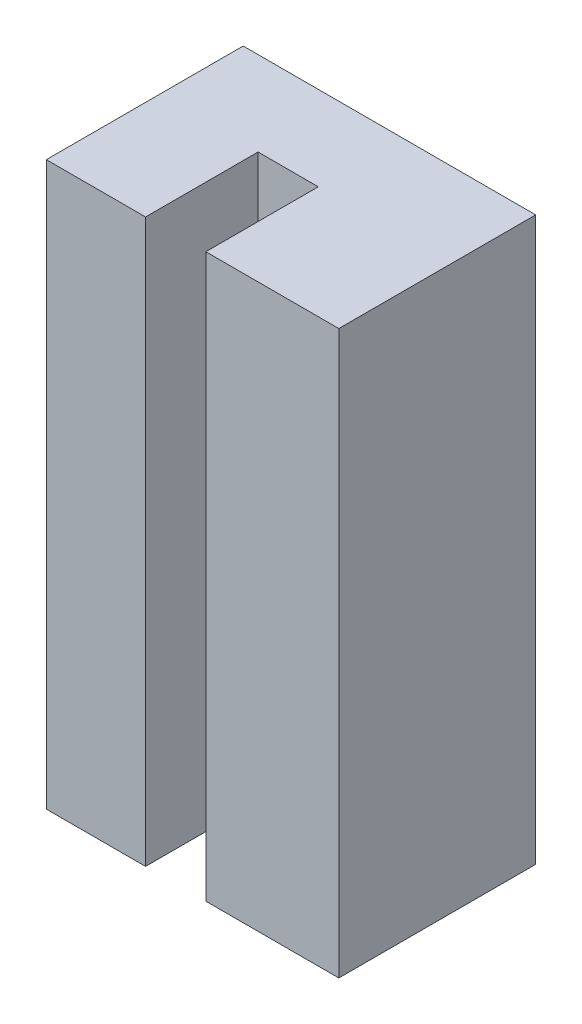
from build123d import *

# Parameters (mm, degrees)
SKETCH_1_W          = 5.2
SKETCH_1_H          = 3.5
EXTRUDE_1_DEPTH     = 10
SKETCH_2_W          = 1.07112
SKETCH_2_H          = 2
CUT_EXTRUDE_1_DEPTH = 10


with BuildPart() as part:
    # Эскиз1 → Бобышка-Вытянуть1 (new body)
    with BuildSketch(Plane(origin=(0, 0, 0), x_dir=(1, 0, 0), z_dir=(0, 1, 0))):
        with Locations((2.6, 1.75)):
            Rectangle(SKETCH_1_W, SKETCH_1_H)
    extrude(amount=EXTRUDE_1_DEPTH)

    # Эскиз2 → Вырез-Вытянуть1 (cut)
    with BuildSketch(Plane(origin=(0, 10, 0), x_dir=(1, 0, 0), z_dir=(0, 1, 0))):
        with Locations((2.29963019, 1)):
            Rectangle(SKETCH_2_W, SKETCH_2_H)
    extrude(amount=-CUT_EXTRUDE_1_DEPTH, mode=Mode.SUBTRACT)


solid = part.part
